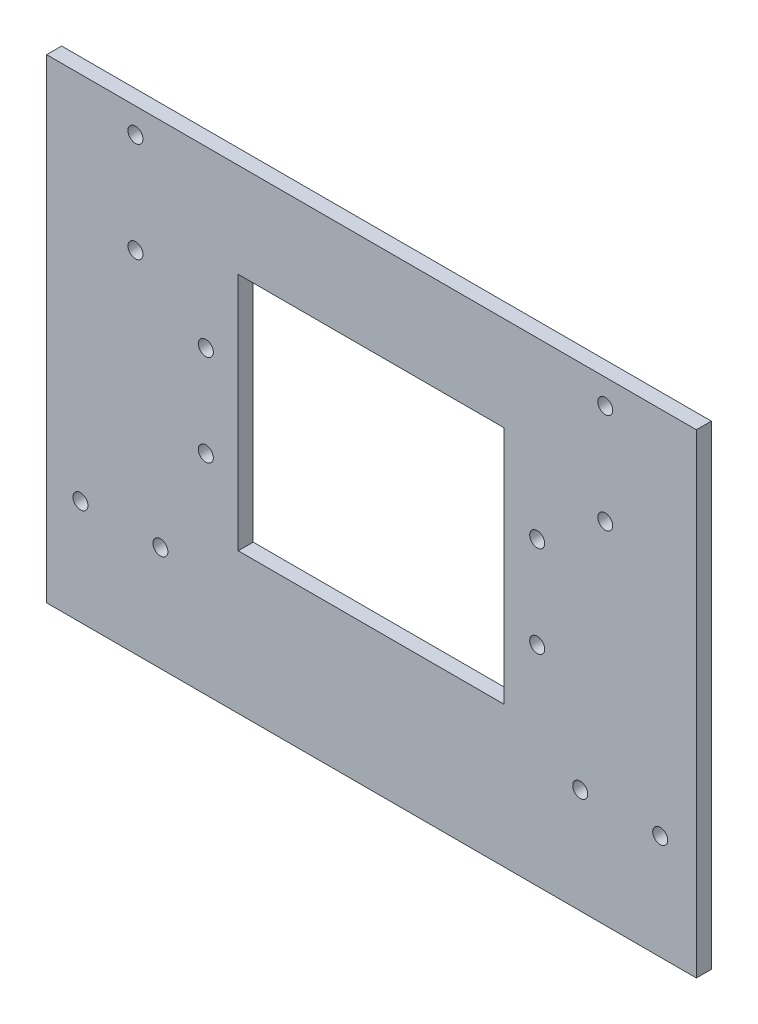
from build123d import *

# Parameters (mm, degrees)
SKETCH_1_W           = 130
SKETCH_1_H           = 95
EXTRUDE_1_DEPTH      = 3
SKETCH_3_R           = 1.5
CUT_EXTRUDE_2_DEPTH  = 10
SKETCH_4_R           = 1.5
CUT_EXTRUDE_3_DEPTH  = 10
SKETCH_15_R          = 12.75
CUT_EXTRUDE_8_DEPTH  = 10
SKETCH_16_R          = 1.25
CUT_EXTRUDE_9_DEPTH  = 10
SKETCH_18_R          = 1.5
SKETCH_18_W          = 53.14997645
SKETCH_18_H          = 47.90789948
CUT_EXTRUDE_10_DEPTH = 10


with BuildPart() as part:
    # 草图1 → 凸台-拉伸1 (new body)
    with BuildSketch(Plane.XY):
        Rectangle(SKETCH_1_W, SKETCH_1_H)
    extrude(amount=EXTRUDE_1_DEPTH)

    # 草图3 → 切除-拉伸2 (cut)
    with BuildSketch(Plane(origin=(0, 0, 0), x_dir=(-1, 0, 0), z_dir=(0, 0, -1))):
        with Locations((-57.767112616, -26.5)):
            Circle(SKETCH_3_R)
        with Locations((-41.767112616, -26.5)):
            Circle(SKETCH_3_R)
        with Locations((42.232887384, -26.5)):
            Circle(SKETCH_3_R)
        with Locations((58.232887384, -26.5)):
            Circle(SKETCH_3_R)
    extrude(amount=-CUT_EXTRUDE_2_DEPTH, mode=Mode.SUBTRACT)

    # 草图4 → 切除-拉伸3 (cut)
    with BuildSketch(Plane(origin=(0, 0, 0), x_dir=(-1, 0, 0), z_dir=(0, 0, -1))):
        with Locations((-46.767112616, 42.5)):
            Circle(SKETCH_4_R)
        with Locations((-46.767112616, 22.5)):
            Circle(SKETCH_4_R)
        with Locations((47.232887384, 42.5)):
            Circle(SKETCH_4_R)
        with Locations((47.232887384, 22.5)):
            Circle(SKETCH_4_R)
    extrude(amount=-CUT_EXTRUDE_3_DEPTH, mode=Mode.SUBTRACT)

    # 草图15 → 切除-拉伸8 (cut)
    with BuildSketch(Plane(origin=(0, 0, 0), x_dir=(-1, 0, 0), z_dir=(0, 0, -1))):
        with Locations((0, 7.452587902)):
            Circle(SKETCH_15_R)
    extrude(amount=-CUT_EXTRUDE_8_DEPTH, mode=Mode.SUBTRACT)

    # 草图16 → 切除-拉伸9 (cut)
    with BuildSketch(Plane(origin=(0, 0, 0), x_dir=(-1, 0, 0), z_dir=(0, 0, -1))):
        with Locations((-15.5, 22.952587902)):
            Circle(SKETCH_16_R)
        with Locations((15.5, 22.952587902)):
            Circle(SKETCH_16_R)
        with Locations((15.5, -8.047412098)):
            Circle(SKETCH_16_R)
        with Locations((-15.5, -8.047412098)):
            Circle(SKETCH_16_R)
    extrude(amount=-CUT_EXTRUDE_9_DEPTH, mode=Mode.SUBTRACT)

    # 草图18 → 切除-拉伸10 (cut)
    with BuildSketch(Plane.XY.offset(3)):
        with Locations((-33.15, 12.602587902)):
            Circle(SKETCH_18_R)
        with Locations((-33.15, -5.697412098)):
            Circle(SKETCH_18_R)
        with Locations((33.15, 12.602587902)):
            Circle(SKETCH_18_R)
        with Locations((33.15, -5.697412098)):
            Circle(SKETCH_18_R)
        with Locations((-0.096851142, 4.648638162)):
            Rectangle(SKETCH_18_W, SKETCH_18_H)
    extrude(amount=-CUT_EXTRUDE_10_DEPTH, mode=Mode.SUBTRACT)


solid = part.part
